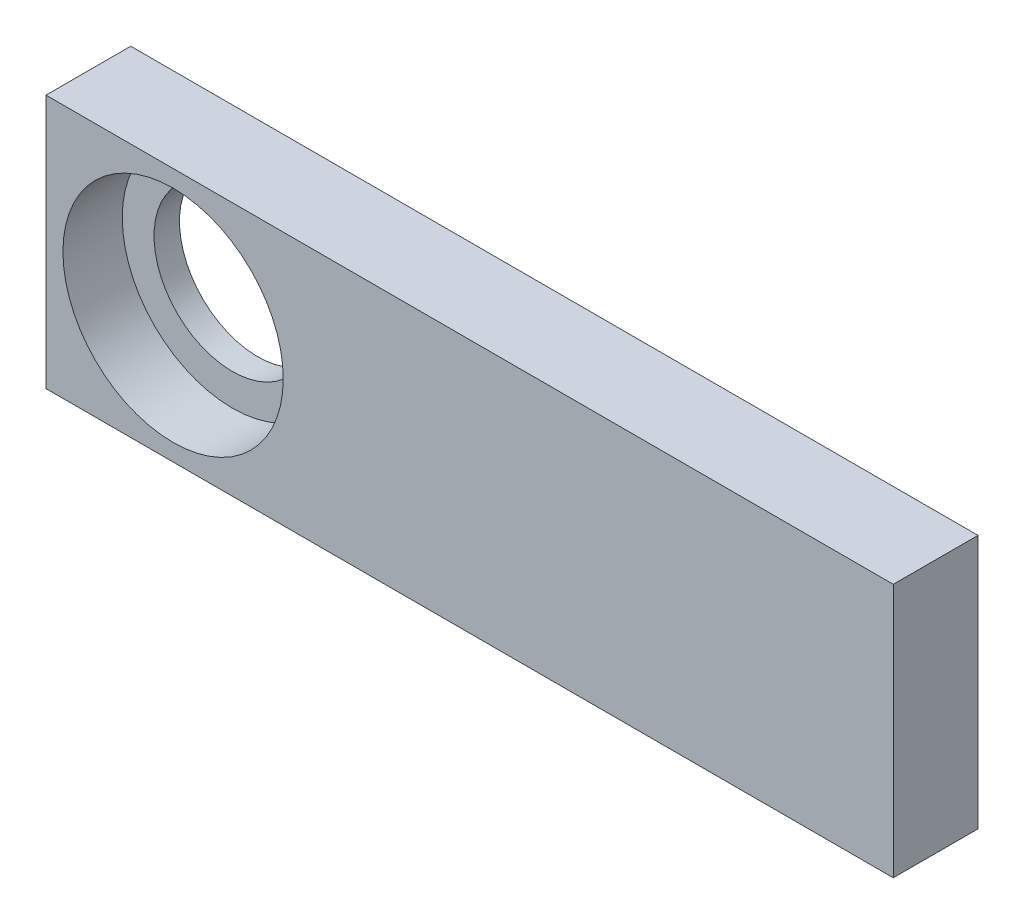
from build123d import *

# Parameters (mm, degrees)
ESBO_O1_W                = 100
ESBO_O1_H                = 30
RESSALTO_EXTRUS_O1_DEPTH = 10
ESBO_O2_R                = 13
CORTE_EXTRUS_O1_DEPTH    = 7
ESBO_O4_R                = 9.25
CORTE_EXTRUS_O3_DEPTH    = 105.637469388
ESBO_O3_W                = 30
ESBO_O3_H                = 30
CORTE_EXTRUS_O2_DEPTH    = 2


with BuildPart() as part:
    # Esboço1 → Ressalto-extrusão1 (new body)
    with BuildSketch(Plane.XY):
        with Locations((50, 15)):
            Rectangle(ESBO_O1_W, ESBO_O1_H)
    extrude(amount=RESSALTO_EXTRUS_O1_DEPTH)

    # Esboço2 → Corte-extrusão1 (cut)
    with BuildSketch(Plane.XY.offset(10)):
        with Locations((15, 15)):
            Circle(ESBO_O2_R)
    extrude(amount=-CORTE_EXTRUS_O1_DEPTH, mode=Mode.SUBTRACT)

    # Esboço4 → Corte-extrusão3 (cut, through all)
    with BuildSketch(Plane.XY.offset(3)):
        with Locations((15, 15)):
            Circle(ESBO_O4_R)
    extrude(amount=-CORTE_EXTRUS_O3_DEPTH, mode=Mode.SUBTRACT)

    # Esboço3 → Corte-extrusão2 (cut)
    with BuildSketch(Plane.XY.offset(10)):
        with Locations((-35, 3.5)):
            Rectangle(ESBO_O3_W, ESBO_O3_H)
    extrude(amount=-CORTE_EXTRUS_O2_DEPTH, mode=Mode.SUBTRACT)


solid = part.part
